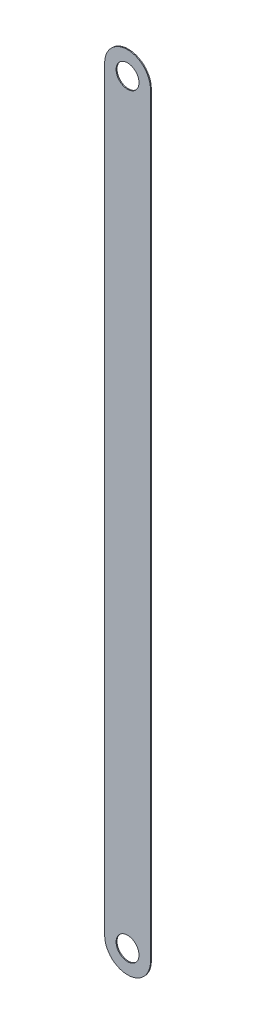
from build123d import *

# Parameters (mm, degrees)
SKETCH2_R           = 3.175
BOSS_EXTRUDE1_DEPTH = 0.254
SCALE1_SCALE        = 1.5
SCALE3_SCALE        = 1.5
SCALE5_SCALE        = 0.667


with BuildPart() as part:
    # Sketch2 → Boss-Extrude1 (new body)
    with BuildSketch(Plane.XY):
        with BuildLine():
            Line((6.35, 209.55), (6.35, 0))
            ThreePointArc((6.35, 0), (0, -6.35), (-6.35, 0))
            Line((-6.35, 0), (-6.35, 209.55))
            ThreePointArc((-6.35, 209.55), (0, 215.9), (6.35, 209.55))
        make_face()
        with Locations((0, 209.55)):
            Circle(SKETCH2_R, mode=Mode.SUBTRACT)
        Circle(SKETCH2_R, mode=Mode.SUBTRACT)
    extrude(amount=BOSS_EXTRUDE1_DEPTH)


with BuildPart() as part_1:
    # Scale1: scaled about (0, 104.775, 0.127)
    add(part.part.scale(SCALE1_SCALE).moved(Location((0, -52.3875, -0.0635))))


with BuildPart() as part_2:
    # Scale3: scaled about (0, 104.775, 0.127)
    add(part_1.part.scale(SCALE3_SCALE).moved(Location((0, -52.3875, -0.0635))))


with BuildPart() as part_3:
    # Scale5: scaled about (0, 104.775, 0.127)
    add(part_2.part.scale(SCALE5_SCALE).moved(Location((0, 34.890075, 0.042291))))


solid = part_3.part
